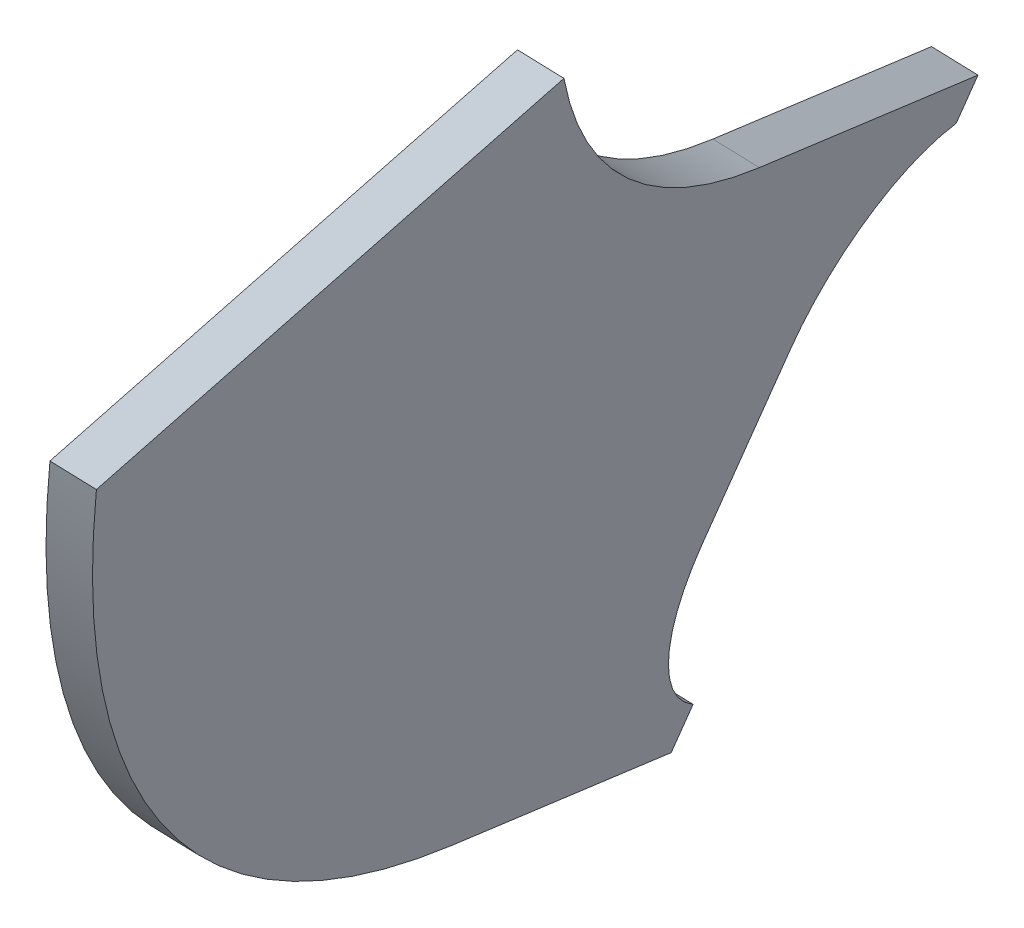
from build123d import *

# Parameters (mm, degrees)
BOSS_EXTRUDE1_DEPTH = 5
CUT_EXTRUDE1_DEPTH  = 152.149714479
BOSS_EXTRUDE2_DEPTH = 1.6
CUT_EXTRUDE2_REACH  = 101.053
FILLET1_R           = 5
SKETCH8_R           = 0.9
CUT_EXTRUDE3_DEPTH  = 175.947714489
CHAMFER1_SIZE       = 1.1
CUT_EXTRUDE4_REACH  = 101.053


with BuildPart() as part:
    # Sketch3 → Boss-Extrude1 (new body)
    with BuildSketch(Plane(origin=(0, 0, 0), x_dir=(-1, 0, 0), z_dir=(0, 0.40673664307580104, 0.9135454576426005))):
        Polygon((-142.43706784, 45.295200471), (-137.485727496, 44.599334966), (-141.048558881, 19.248472407), (-145.999899225, 19.944337911), align=None)
    extrude(amount=-BOSS_EXTRUDE1_DEPTH)

    # Sketch4 → Cut-Extrude1 (cut, through all)
    with BuildSketch(Plane(origin=(-3.483639423, -22.644400664, 10.081936737), x_dir=(0.9902680687415713, -0.12714095420809696, 0.056606799890943936), z_dir=(-0.13917310096005903, -0.9046548960473729, 0.4027783100251033))):
        with BuildLine():
            Line((146.507886552, 0), (144.854753595, 0))
            ThreePointArc((144.854753595, 0), (145.65008791, -0.129885377), (146.362780386, -0.506045337))
            Line((146.362780386, -0.506045337), (146.507886552, 0))
        make_face()
        with BuildLine():
            Line((142.354753595, 0), (142.354753595, -2.5))
            ThreePointArc((142.354753595, -2.5), (143.086986642, -0.732233047), (144.854753595, 0))
            Line((144.854753595, 0), (142.354753595, 0))
        make_face()
        with BuildLine():
            Line((142.354753595, -5), (144.854753595, -5))
            ThreePointArc((144.854753595, -5), (143.086986642, -4.267766953), (142.354753595, -2.5))
            Line((142.354753595, -2.5), (142.354753595, -5))
        make_face()
        with BuildLine():
            Line((147.354753595, -5), (147.354753595, -2.851352087))
            Line((147.354753595, -2.851352087), (147.257907835, -3.18909339))
            ThreePointArc((147.257907835, -3.18909339), (146.359291153, -4.496588775), (144.854753595, -5))
            Line((144.854753595, -5), (147.354753595, -5))
        make_face()
    extrude(amount=-CUT_EXTRUDE1_DEPTH, mode=Mode.SUBTRACT)

    # 3DSketch1 → Boss-Extrude2 (add)
    with BuildSketch(Plane(origin=(145.903995961, -19.504867382, 5.193229142), x_dir=(0.26692941591244046, 0.317996421638383, 0.9097400522928664), z_dir=(-0.9519067631920917, 0.23432754207656112, 0.1973933058984336))):
        with BuildLine():
            Line((0, 0), (18.020194743, 0.750238039))
            ThreePointArc((18.020194743, 0.750238039), (27.757448286, 3.045703126), (35.949753791, 8.787601507))
            Line((35.949753791, 8.787601507), (61.336751154, 0))
            ThreePointArc((61.336751154, 0), (43.312353527, -17.691834348), (19.085081694, -24.827604243))
            Line((19.085081694, -24.827604243), (1.064886951, -25.577842282))
            Line((1.064886951, -25.577842282), (0, 0))
        make_face()
    extrude(amount=BOSS_EXTRUDE2_DEPTH)

    # SurfaceCut1
    split(bisect_by=Plane(origin=(0, 0, 0), x_dir=(1, 0, 0), z_dir=(0, 1, 0)), keep=Keep.BOTTOM)

    # Sketch7 → Cut-Extrude2 (cut, up to next)
    with BuildSketch(Plane(origin=(135.582383415, -33.375838772, -28.115206151), x_dir=(-0.1909616440160216, 0.05006214034989929, -0.9803200664162116), z_dir=(0.9519067631921003, -0.23432754207656978, -0.197393305898382)), mode=Mode.PRIVATE) as cut_extrude2_sk1:
        Polygon((-42.660506239, 14.950285755), (-33.555755259, 10.814646797), (-40.338203151, -4.11714481), (-49.44295413, 0.018494148), align=None)
    cut_extrude2_tool1 = extrude(cut_extrude2_sk1.sketch, amount=-CUT_EXTRUDE2_REACH, mode=Mode.PRIVATE) & part.part
    add(cut_extrude2_tool1.solids().sort_by_distance((144.804967, -30.194611, 12.58319))[0], mode=Mode.SUBTRACT)

    # Fillet1
    fillet1_edges = [part.edges().sort_by_distance(p)[0] for p in [
        (146.549435826, -20.809301178, 13.907118047),
        (144.26699697, -35.645641474, 20.512682331),
    ]]
    fillet(fillet1_edges, radius=FILLET1_R)

    # Sketch8 → Cut-Extrude3 (cut, through all)
    with BuildSketch(Plane(origin=(-3.483639423, -22.644400664, 10.081936737), x_dir=(-0.9902680687415713, 0.12714095420809696, -0.056606799890943936), z_dir=(-0.13917310096005903, -0.9046548960473729, 0.4027783100251033))):
        with Locations(Location((-144.854753595, 2.5, 0), (0, 0, 90))):
            Circle(SKETCH8_R)
    extrude(amount=-CUT_EXTRUDE3_DEPTH, mode=Mode.SUBTRACT)

    # Chamfer1
    chamfer1_edges = [part.edges().sort_by_distance(p)[0] for p in [
        (143.524229053, -18.552985548, 6.508903318),
        (139.961397668, -41.712150887, 16.820028055),
    ]]
    chamfer(chamfer1_edges, length=CHAMFER1_SIZE)

    # SurfaceCut2
    split(bisect_by=Plane(origin=(10.924807763, 14.246045613, 35.772021304), x_dir=(0.9620268384206857, -0.10098922508518503, -0.2535853674307606), z_dir=(0.27295487201788504, 0.355935558889345, 0.8937592045734856)), keep=Keep.TOP)

    # Sketch9 → Cut-Extrude4 (cut, up to next)
    with BuildSketch(Plane(origin=(135.582383415, -33.375838772, -28.115206151), x_dir=(-0.1916712747682247, 0.047183044012121235, -0.9803243763094306), z_dir=(0.9519067631920741, -0.23432754207660406, -0.19739330589846776)), mode=Mode.PRIVATE) as cut_extrude4_sk1:
        with BuildLine():
            Line((-38.146163081, 12.769409099), (-36.256196585, 16.96321723))
            Line((-36.256196585, 16.96321723), (-50.420150266, 23.346293676))
            ThreePointArc((-50.420150266, 23.346293676), (-58.601061454, 29.10441478), (-64.064181125, 37.485201734))
            Line((-64.064181125, 37.485201734), (-90.897397483, 38.789071088))
            ThreePointArc((-90.897397483, 38.789071088), (-80.762444903, 15.655488385), (-60.938224677, 0.006839726))
            Line((-60.938224677, 0.006839726), (-46.774270996, -6.37623672))
            Line((-46.774270996, -6.37623672), (-44.8843045, -2.182428588))
            ThreePointArc((-44.8843045, -2.182428588), (-47.505947759, 0.605338899), (-47.388480191, 4.43036992))
            Line((-47.388480191, 4.43036992), (-44.758961589, 10.265233407))
            ThreePointArc((-44.758961589, 10.265233407), (-41.971194102, 12.886876667), (-38.146163081, 12.769409099))
        make_face()
        with BuildLine():
            Line((-60.280845026, 1.465555598), (-47.575607217, -4.260141197))
            Line((-47.575607217, -4.260141197), (-46.919511198, -2.804273685))
            ThreePointArc((-46.919511198, -2.804273685), (-49.241503093, 0.809999924), (-48.847196063, 5.087749571))
            Line((-48.847196063, 5.087749571), (-46.217677461, 10.922613058))
            ThreePointArc((-46.217677461, 10.922613058), (-43.274123535, 14.051528264), (-39.028388127, 14.706013497))
            Line((-39.028388127, 14.706013497), (-38.372292108, 16.161881009))
            Line((-38.372292108, 16.161881009), (-51.077529917, 21.887577804))
            ThreePointArc((-51.077529917, 21.887577804), (-59.392005247, 27.626678002), (-65.139212663, 35.935551452))
            Line((-65.139212663, 35.935551452), (-88.946453277, 37.092383753))
            ThreePointArc((-88.946453277, 37.092383753), (-78.877215258, 15.848472994), (-60.280845026, 1.465555598))
        make_face(mode=Mode.SUBTRACT)
    cut_extrude4_tool1 = extrude(cut_extrude4_sk1.sketch, amount=-CUT_EXTRUDE4_REACH, mode=Mode.PRIVATE) & part.part
    add(cut_extrude4_tool1.solids().sort_by_distance((146.459786, -20.443408, 8.987614))[0], mode=Mode.SUBTRACT)


solid = part.part
